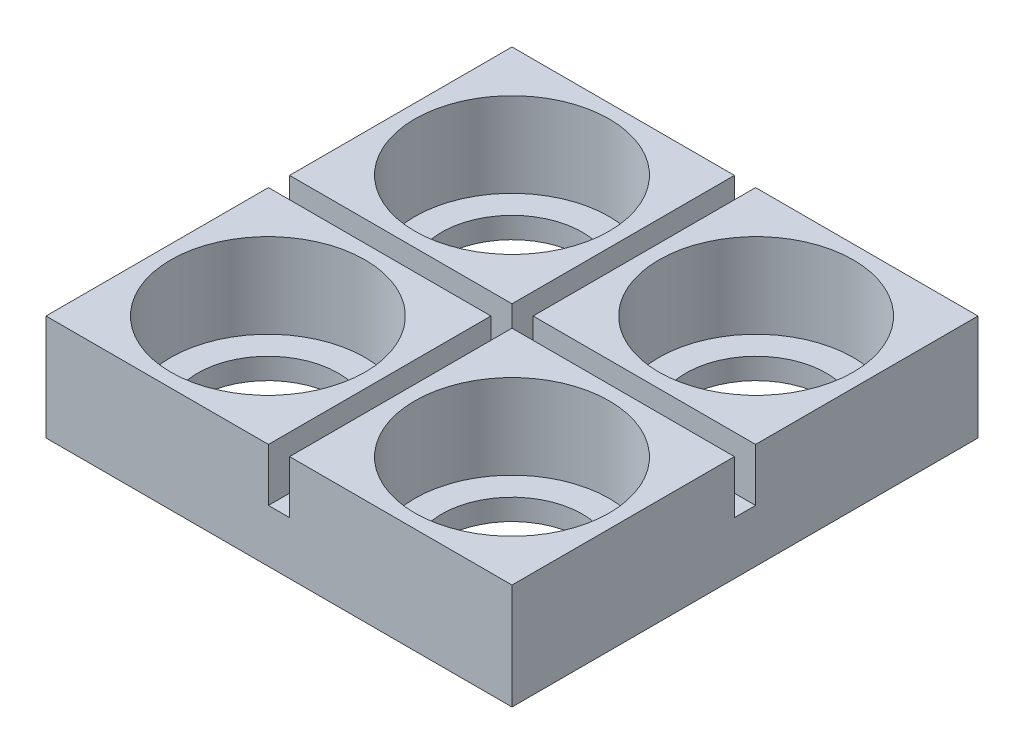
from build123d import *

# Parameters (mm, degrees)
SKETCH1_W               = 44.1
SKETCH1_H               = 44.1
BOSS_EXTRUDE1_DEPTH     = 10
SKETCH2_R               = 9.2
CUT_EXTRUDE1_DEPTH      = 8
SKETCH5_R               = 6.65
CUT_EXTRUDE4_DEPTH      = 50.9501001
MIRROR2_COPY_1_SKETCH_R = 9.2
MIRROR2_COPY_1_DEPTH    = 8
MIRROR2_COPY_2_SKETCH_R = 6.65
MIRROR2_COPY_2_DEPTH    = 50.9501001
CUT_EXTRUDE3_DEPTH      = 5


with BuildPart() as part:
    # Sketch1 → Boss-Extrude1 (new body)
    with BuildSketch(Plane(origin=(0, 0, 0), x_dir=(1, 0, 0), z_dir=(0, 1, 0))):
        with Locations((22.05, 0)):
            Rectangle(SKETCH1_W, SKETCH1_H)
    extrude(amount=BOSS_EXTRUDE1_DEPTH)

    # Sketch2 → Cut-Extrude1 (cut)
    with BuildSketch(Plane(origin=(0, 10, 0), x_dir=(1, 0, 0), z_dir=(0, 1, 0))):
        with Locations(Location((10.5, 11.55, 0), (0, 0, 270))):
            Circle(SKETCH2_R)
    cut_extrude1 = extrude(amount=-CUT_EXTRUDE1_DEPTH, mode=Mode.SUBTRACT)

    # Sketch5 → Cut-Extrude4 (cut, through all)
    with BuildSketch(Plane(origin=(0, 2, 0), x_dir=(1, 0, 0), z_dir=(0, 1, 0))):
        with Locations(Location((10.5, 11.55, 0), (0, 0, 270))):
            Circle(SKETCH5_R)
    cut_extrude4 = extrude(amount=-CUT_EXTRUDE4_DEPTH, mode=Mode.SUBTRACT)

    # Mirror1: Cut-Extrude1, Cut-Extrude4 across plane
    add(cut_extrude1.mirror(Plane.XY), mode=Mode.SUBTRACT)
    add(cut_extrude4.mirror(Plane.XY), mode=Mode.SUBTRACT)

    # Mirror2: Cut-Extrude1, Cut-Extrude4 across plane
    add(cut_extrude1.mirror(Plane(origin=(22.05, 0, 0), x_dir=(0, 0, 1), z_dir=(1, 0, 0))), mode=Mode.SUBTRACT)
    add(cut_extrude4.mirror(Plane(origin=(22.05, 0, 0), x_dir=(0, 0, 1), z_dir=(1, 0, 0))), mode=Mode.SUBTRACT)

    # Mirror2 copy 1 sketch → Mirror2 copy 1 (cut)
    with BuildSketch(Plane(origin=(44.1, 10, 0), x_dir=(-1, 0, 0), z_dir=(0, 1, 0))):
        with Locations(Location((10.5, 11.55, 0), (0, 0, 270))):
            Circle(MIRROR2_COPY_1_SKETCH_R)
    extrude(amount=-MIRROR2_COPY_1_DEPTH, mode=Mode.SUBTRACT)

    # Mirror2 copy 2 sketch → Mirror2 copy 2 (cut, through all)
    with BuildSketch(Plane(origin=(44.1, 2, 0), x_dir=(-1, 0, 0), z_dir=(0, 1, 0))):
        with Locations(Location((10.5, 11.55, 0), (0, 0, 270))):
            Circle(MIRROR2_COPY_2_SKETCH_R)
    extrude(amount=-MIRROR2_COPY_2_DEPTH, mode=Mode.SUBTRACT)

    # Sketch4 → Cut-Extrude3 (cut)
    with BuildSketch(Plane(origin=(0, 10, 0), x_dir=(1, 0, 0), z_dir=(0, 1, 0))):
        Polygon((21.05, 22.05), (23.05, 22.05), (23.05, 1), (46.251393124, 1), (46.251393124, -1), (23.05, -1), (23.05, -23.362709558), (21.05, -23.362709558), (21.05, -1), (0, -1), (0, 1), (21.05, 1), align=None)
    extrude(amount=-CUT_EXTRUDE3_DEPTH, mode=Mode.SUBTRACT)


solid = part.part
